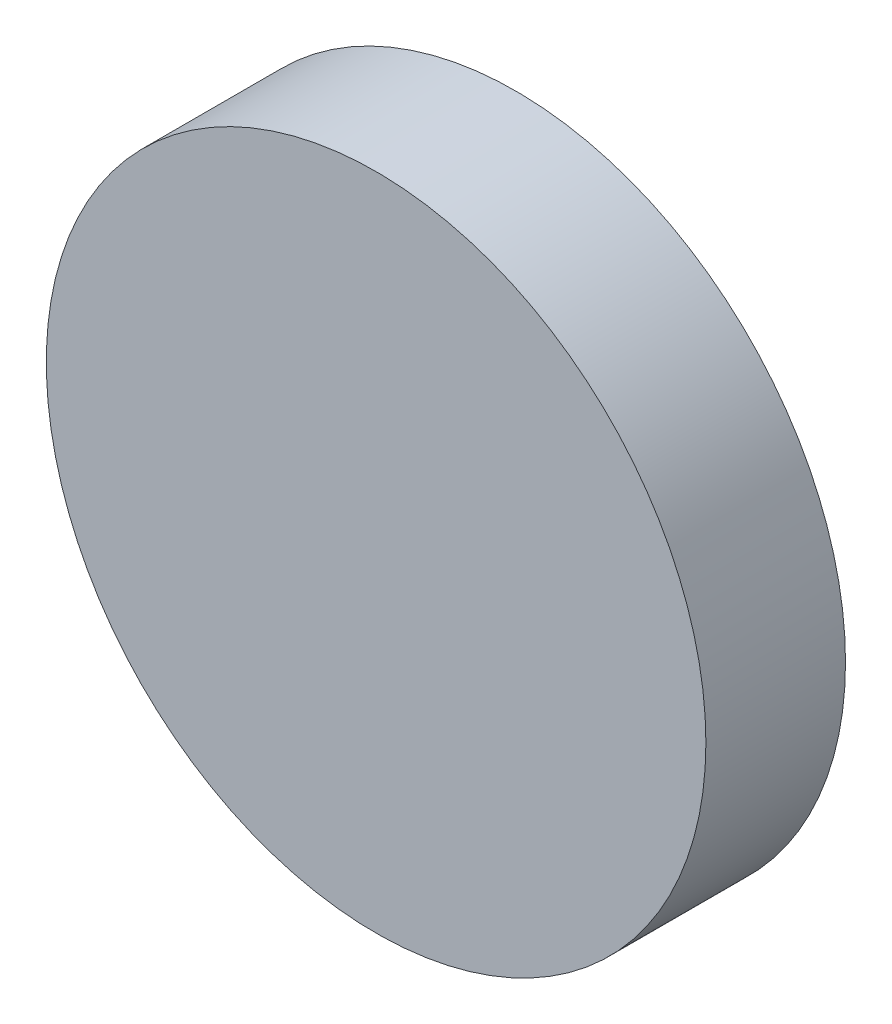
from build123d import *

# Parameters (mm, degrees)
SKETCH1_R           = 7.5
BOSS_EXTRUDE1_DEPTH = 3.175


with BuildPart() as part:
    # Sketch1 → Boss-Extrude1 (new body)
    with BuildSketch(Plane.XY):
        Circle(SKETCH1_R)
    extrude(amount=BOSS_EXTRUDE1_DEPTH)


solid = part.part
